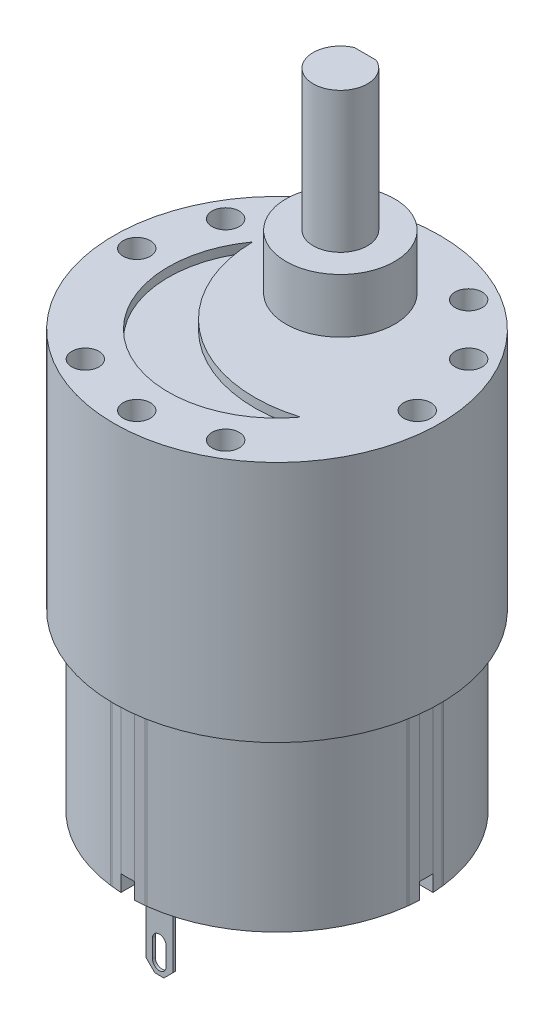
from build123d import *

# Parameters (mm, degrees)
SKETCH4_R            = 18
BOSS_EXTRUDE1_DEPTH  = 26.8
CUT_EXTRUDE1_DEPTH   = 1
SKETCH4_5_R          = 6
BOSS_EXTRUDE2_DEPTH  = 6
BOSS_EXTRUDE3_DEPTH  = 9.5
BOSS_EXTRUDE4_DEPTH  = 21.5
SKETCH4_9_R          = 1.5
CUT_EXTRUDE2_DEPTH   = 6
SKETCH5_W            = 3
SKETCH5_H            = 7
BOSS_EXTRUDE6_DEPTH  = 19.2
BOSS_EXTRUDE8_DEPTH  = 21.7
BOSS_EXTRUDE9_DEPTH  = 21.5
BOSS_EXTRUDE10_DEPTH = 17.4
BOSS_EXTRUDE11_DEPTH = 19.2
SKETCH5_15_W         = 3
SKETCH5_15_H         = 0.3
BOSS_EXTRUDE16_DEPTH = 28.5
CUT_EXTRUDE4_DEPTH   = 28.5
SKETCH5_11_R         = 3.5
SKETCH5_11_R_2       = 1.4
BOSS_EXTRUDE12_DEPTH = 25.2
SKETCH5_12_R         = 1.4
BOSS_EXTRUDE13_DEPTH = 25
BOSS_EXTRUDE14_DEPTH = 16
SKETCH5_14_W         = 3
SKETCH5_14_H         = 7
BOSS_EXTRUDE15_DEPTH = 17
CUT_EXTRUDE3_DEPTH   = 28.5


with BuildPart() as part:
    # Sketch4 → Boss-Extrude1 (new body)
    with BuildSketch(Plane(origin=(0, 0, 0), x_dir=(1, 0, 0), z_dir=(0, 1, 0))):
        Circle(SKETCH4_R)
    extrude(amount=-BOSS_EXTRUDE1_DEPTH)

    # Sketch4<4> → Cut-Extrude1 (cut)
    with BuildSketch(Plane(origin=(0, 0, 0), x_dir=(1, 0, 0), z_dir=(0, 1, 0))):
        with BuildLine():
            ThreePointArc((-9.722284336, 7.034002224), (-3.543208702, -4.874728217), (9.691213914, -7.07674875))
            ThreePointArc((9.691213914, -7.07674875), (-7.05539259, -9.706772656), (-9.722284336, 7.034002224))
        make_face()
    extrude(amount=-CUT_EXTRUDE1_DEPTH, mode=Mode.SUBTRACT)

    # Sketch4<9> → Cut-Extrude2 (cut)
    with BuildSketch(Plane(origin=(0, 0, 0), x_dir=(1, 0, 0), z_dir=(0, 1, 0))):
        with Locations((7.75, -13.423393759)):
            Circle(SKETCH4_9_R)
        with Locations((7.75, 13.423393759)):
            Circle(SKETCH4_9_R)
        with Locations((15.5, 0)):
            Circle(SKETCH4_9_R)
        with Locations((-15.5, 0)):
            Circle(SKETCH4_9_R)
        with Locations((-7.75, -13.423393759)):
            Circle(SKETCH4_9_R)
        with Locations((-13.423393759, 7.75)):
            Circle(SKETCH4_9_R)
        with Locations((0, -15.5)):
            Circle(SKETCH4_9_R)
        with Locations((-7.75, 13.423393759)):
            Circle(SKETCH4_9_R)
        with Locations((13.423393759, 7.75)):
            Circle(SKETCH4_9_R)
    extrude(amount=-CUT_EXTRUDE2_DEPTH, mode=Mode.SUBTRACT)

    # Sketch5 → Boss-Extrude6 (add)
    with BuildSketch(Plane.XZ.offset(26.8)):
        with BuildLine():
            Line((2, -13.5), (2, -16.378339354))
            ThreePointArc((2, -16.378339354), (11.66726189, -11.66726189), (16.378339354, -2))
            Line((16.378339354, -2), (13.5, -2))
            Line((13.5, -2), (13.5, 2))
            Line((13.5, 2), (16.378339354, 2))
            ThreePointArc((16.378339354, 2), (11.66726189, 11.66726189), (2, 16.378339354))
            Line((2, 16.378339354), (2, 13.5))
            Line((2, 13.5), (-2, 13.5))
            Line((-2, 13.5), (-2, 16.378339354))
            ThreePointArc((-2, 16.378339354), (-11.66726189, 11.66726189), (-16.378339354, 2))
            Line((-16.378339354, 2), (-13.5, 2))
            Line((-13.5, 2), (-13.5, -2))
            Line((-13.5, -2), (-16.378339354, -2))
            ThreePointArc((-16.378339354, -2), (-11.66726189, -11.66726189), (-2, -16.378339354))
            Line((-2, -16.378339354), (-2, -13.5))
            Line((-2, -13.5), (2, -13.5))
        make_face()
        with BuildLine():
            ThreePointArc((-5.891000616, 2.747018701), (-5.226537591, 2.988863464), (-4.984692829, 2.32440044))
            ThreePointArc((-4.984692829, 2.32440044), (-5.494765219, -0.239906631), (-4.763139721, -2.75))
            ThreePointArc((-4.763139721, -2.75), (-4.946152423, -3.433012702), (-5.629165125, -3.25))
            ThreePointArc((-5.629165125, -3.25), (-6.49381344, -0.283526018), (-5.891000616, 2.747018701))
        make_face(mode=Mode.SUBTRACT)
        Polygon((-1.5, -13), (-1.5, -12.7), (-0.5, -12.7), (0.5, -12.7), (1.5, -12.7), (1.5, -13), (0.5, -13), (-0.5, -13), align=None, mode=Mode.SUBTRACT)
        with BuildLine():
            ThreePointArc((-2.852673267, -6.117577562), (-3.215440411, -5.120883026), (-2.218745874, -4.758115882))
            ThreePointArc((-2.218745874, -4.758115882), (0, -5.25), (2.218745874, -4.758115882))
            ThreePointArc((2.218745874, -4.758115882), (3.215440411, -5.120883026), (2.852673267, -6.117577562))
            ThreePointArc((2.852673267, -6.117577562), (0, -6.75), (-2.852673267, -6.117577562))
        make_face(mode=Mode.SUBTRACT)
        with BuildLine():
            ThreePointArc((4.984692829, 2.32440044), (5.226537591, 2.988863464), (5.891000616, 2.747018701))
            ThreePointArc((5.891000616, 2.747018701), (6.49381344, -0.283526018), (5.629165125, -3.25))
            ThreePointArc((5.629165125, -3.25), (4.946152423, -3.433012702), (4.763139721, -2.75))
            ThreePointArc((4.763139721, -2.75), (5.494765219, -0.239906631), (4.984692829, 2.32440044))
        make_face(mode=Mode.SUBTRACT)
        with Locations((-10.5, 0)):
            Rectangle(SKETCH5_W, SKETCH5_H, mode=Mode.SUBTRACT)
        with BuildLine():
            ThreePointArc((3.5, 0), (0, -3.5), (-3.5, 0))
            ThreePointArc((-3.5, 0), (0, 3.5), (3.5, 0))
        make_face(mode=Mode.SUBTRACT)
        with BuildLine():
            ThreePointArc((2.852673267, 6.117577563), (3.215440411, 5.120883026), (2.218745874, 4.758115882))
            ThreePointArc((2.218745874, 4.758115882), (0, 5.25), (-2.218745874, 4.758115882))
            ThreePointArc((-2.218745874, 4.758115882), (-3.215435657, 5.120885242), (-2.852673267, 6.117577562))
            ThreePointArc((-2.852673267, 6.117577562), (0, 6.75), (2.852673267, 6.117577563))
        make_face(mode=Mode.SUBTRACT)
        with BuildLine():
            ThreePointArc((10.399755544, 1.496672836), (10.49982303, 1.500015644), (10.599890599, 1.496675333))
            ThreePointArc((10.599890599, 1.496675333), (11.560488683, 1.060689048), (11.996498936, 0.100101844))
            ThreePointArc((11.996498936, 0.100101844), (11.999005809, 0.050086648), (11.999841744, 1.5644e-05))
            ThreePointArc((11.999841744, 1.5644e-05), (11.999006434, -0.050036657), (11.996501433, -0.100033212))
            ThreePointArc((11.996501433, -0.100033212), (11.560515148, -1.060631295), (10.599927944, -1.496641549))
            ThreePointArc((10.599927944, -1.496641549), (10.499860458, -1.499984356), (10.399792888, -1.496644046))
            ThreePointArc((10.399792888, -1.496644046), (9.439194805, -1.060657761), (9.003184551, -0.100070556))
            ThreePointArc((9.003184551, -0.100070556), (8.999841744, -3.07e-06), (9.003182054, 0.100064499))
            ThreePointArc((9.003182054, 0.100064499), (9.439168339, 1.060662583), (10.399755544, 1.496672836))
        make_face(mode=Mode.SUBTRACT)
        Polygon((-1.5, 12.7), (-1.5, 13), (-0.5, 13), (0.5, 13), (1.5, 13), (1.5, 12.7), (0.5, 12.7), (-0.5, 12.7), align=None, mode=Mode.SUBTRACT)
    extrude(amount=BOSS_EXTRUDE6_DEPTH)

    # Sketch5<6> → Boss-Extrude8 (add)
    with BuildSketch(Plane.XZ.offset(26.8)):
        with BuildLine():
            Line((11.996498936, 0.100101844), (10.599908023, 0.10008442))
            Line((10.599908023, 0.10008442), (10.599890599, 1.496675333))
            ThreePointArc((10.599890599, 1.496675333), (10.49982303, 1.500015644), (10.399755544, 1.496672836))
            Line((10.399755544, 1.496672836), (10.399772967, 0.100081923))
            Line((10.399772967, 0.100081923), (9.003182054, 0.100064499))
            ThreePointArc((9.003182054, 0.100064499), (8.999841744, -3.07e-06), (9.003184551, -0.100070556))
            Line((9.003184551, -0.100070556), (10.399775464, -0.100053133))
            Line((10.399775464, -0.100053133), (10.399792888, -1.496644046))
            ThreePointArc((10.399792888, -1.496644046), (10.499860458, -1.499984356), (10.599927944, -1.496641549))
            Line((10.599927944, -1.496641549), (10.59991052, -0.100050636))
            Line((10.59991052, -0.100050636), (11.996501433, -0.100033212))
            ThreePointArc((11.996501433, -0.100033212), (11.999006434, -0.050036657), (11.999841744, 1.5644e-05))
            ThreePointArc((11.999841744, 1.5644e-05), (11.999005809, 0.050086648), (11.996498936, 0.100101844))
        make_face()
    extrude(amount=BOSS_EXTRUDE8_DEPTH)

    # Sketch5<7> → Boss-Extrude9 (add)
    with BuildSketch(Plane.XZ.offset(26.8)):
        with BuildLine():
            Line((10.599890599, 1.496675333), (10.599908023, 0.10008442))
            Line((10.599908023, 0.10008442), (11.996498936, 0.100101844))
            ThreePointArc((11.996498936, 0.100101844), (11.560488683, 1.060689048), (10.599890599, 1.496675333))
        make_face()
        with BuildLine():
            Line((10.399772967, 0.100081923), (10.399755544, 1.496672836))
            ThreePointArc((10.399755544, 1.496672836), (9.439168339, 1.060662583), (9.003182054, 0.100064499))
            Line((9.003182054, 0.100064499), (10.399772967, 0.100081923))
        make_face()
        with BuildLine():
            ThreePointArc((10.599927944, -1.496641549), (11.560515148, -1.060631295), (11.996501433, -0.100033212))
            Line((11.996501433, -0.100033212), (10.59991052, -0.100050636))
            Line((10.59991052, -0.100050636), (10.599927944, -1.496641549))
        make_face()
        with BuildLine():
            Line((10.399775464, -0.100053133), (9.003184551, -0.100070556))
            ThreePointArc((9.003184551, -0.100070556), (9.439194805, -1.060657761), (10.399792888, -1.496644046))
            Line((10.399792888, -1.496644046), (10.399775464, -0.100053133))
        make_face()
    extrude(amount=BOSS_EXTRUDE9_DEPTH)

    # Sketch5<8> → Boss-Extrude10 (add)
    with BuildSketch(Plane.XZ.offset(26.8)):
        with BuildLine():
            ThreePointArc((-0.75, -16.482945732), (0, -16.5), (0.75, -16.482945732))
            Line((0.75, -16.482945732), (0.75, -14.7))
            Line((0.75, -14.7), (-0.75, -14.7))
            Line((-0.75, -14.7), (-0.75, -16.482945732))
        make_face()
        with BuildLine():
            Line((14.7, -0.75), (16.482945732, -0.75))
            ThreePointArc((16.482945732, -0.75), (16.5, 0), (16.482945732, 0.75))
            Line((16.482945732, 0.75), (14.7, 0.75))
            Line((14.7, 0.75), (14.7, -0.75))
        make_face()
        with BuildLine():
            ThreePointArc((-16.482945732, 0.75), (-16.5, 0), (-16.482945732, -0.75))
            Line((-16.482945732, -0.75), (-14.7, -0.75))
            Line((-14.7, -0.75), (-14.7, 0.75))
            Line((-14.7, 0.75), (-16.482945732, 0.75))
        make_face()
        with BuildLine():
            Line((0.75, 14.7), (0.75, 16.482945732))
            ThreePointArc((0.75, 16.482945732), (0, 16.5), (-0.75, 16.482945732))
            Line((-0.75, 16.482945732), (-0.75, 14.7))
            Line((-0.75, 14.7), (0.75, 14.7))
        make_face()
    extrude(amount=BOSS_EXTRUDE10_DEPTH)

    # Sketch5<10> → Boss-Extrude11 (add)
    with BuildSketch(Plane.XZ.offset(26.8)):
        Polygon((0.75, -14.7), (0.75, -16.482945732), (1.808254963, -16.400616268), (1.99, -16.379501153), (1.99, -13.51), (-1.99, -13.51), (-1.99, -16.379501153), (-1.808254963, -16.400616268), (-0.75, -16.482945732), (-0.75, -14.7), align=None)
        Polygon((13.51, -1.99), (16.379501153, -1.99), (16.400616268, -1.808254963), (16.482945732, -0.75), (14.7, -0.75), (14.7, 0.75), (16.482945732, 0.75), (16.400616268, 1.808254963), (16.379501153, 1.99), (13.51, 1.99), align=None)
        Polygon((-16.400616268, -1.808254963), (-16.379501153, -1.99), (-13.51, -1.99), (-13.51, 1.99), (-16.379501153, 1.99), (-16.400616268, 1.808254963), (-16.482945732, 0.75), (-14.7, 0.75), (-14.7, -0.75), (-16.482945732, -0.75), align=None)
        Polygon((1.99, 13.51), (1.99, 16.379501153), (1.808254963, 16.400616268), (0.75, 16.482945732), (0.75, 14.7), (-0.75, 14.7), (-0.75, 16.482945732), (-1.808254963, 16.400616268), (-1.99, 16.379501153), (-1.99, 13.51), align=None)
    extrude(amount=BOSS_EXTRUDE11_DEPTH)

    # Sketch5<15> → Boss-Extrude16 (add)
    with BuildSketch(Plane.XZ.offset(26.8)):
        with Locations((0, 12.85)):
            Rectangle(SKETCH5_15_W, SKETCH5_15_H)
        with Locations((0, -12.85)):
            Rectangle(SKETCH5_15_W, SKETCH5_15_H)
    extrude(amount=BOSS_EXTRUDE16_DEPTH)

    # Sketch9 → Cut-Extrude4 (cut)
    with BuildSketch(Plane.XY.offset(13)):
        with BuildLine():
            Line((-0.75, -54.1), (-0.75, -52.1))
            ThreePointArc((-0.75, -52.1), (0, -51.35), (0.75, -52.1))
            Line((0.75, -52.1), (0.75, -54.1))
            ThreePointArc((0.75, -54.1), (0, -54.85), (-0.75, -54.1))
        make_face()
    extrude(amount=-CUT_EXTRUDE4_DEPTH, mode=Mode.SUBTRACT)

    # Sketch5<11> → Boss-Extrude12 (add)
    with BuildSketch(Plane.XZ.offset(26.8)):
        Circle(SKETCH5_11_R)
        Circle(SKETCH5_11_R_2, mode=Mode.SUBTRACT)
    extrude(amount=BOSS_EXTRUDE12_DEPTH)

    # Sketch5<12> → Boss-Extrude13 (add)
    with BuildSketch(Plane.XZ.offset(26.8)):
        Circle(SKETCH5_12_R)
    extrude(amount=BOSS_EXTRUDE13_DEPTH)

    # Sketch5<13> → Boss-Extrude14 (add)
    with BuildSketch(Plane.XZ.offset(26.8)):
        with BuildLine():
            ThreePointArc((5.629165125, -3.25), (6.49381344, -0.283526018), (5.891000616, 2.747018701))
            ThreePointArc((5.891000616, 2.747018701), (5.226537591, 2.988863464), (4.984692829, 2.32440044))
            ThreePointArc((4.984692829, 2.32440044), (5.494765219, -0.239906631), (4.763139721, -2.75))
            ThreePointArc((4.763139721, -2.75), (4.946152423, -3.433012702), (5.629165125, -3.25))
        make_face()
        with BuildLine():
            ThreePointArc((2.218745874, -4.758115882), (0, -5.25), (-2.218745874, -4.758115882))
            ThreePointArc((-2.218745874, -4.758115882), (-3.215440411, -5.120883026), (-2.852673267, -6.117577562))
            ThreePointArc((-2.852673267, -6.117577562), (0, -6.75), (2.852673267, -6.117577562))
            ThreePointArc((2.852673267, -6.117577562), (3.215440411, -5.120883026), (2.218745874, -4.758115882))
        make_face()
        with BuildLine():
            ThreePointArc((-2.218745874, 4.758115882), (0, 5.25), (2.218745874, 4.758115882))
            ThreePointArc((2.218745874, 4.758115882), (3.215440411, 5.120883026), (2.852673267, 6.117577563))
            ThreePointArc((2.852673267, 6.117577563), (0, 6.75), (-2.852673267, 6.117577562))
            ThreePointArc((-2.852673267, 6.117577562), (-3.215435657, 5.120885242), (-2.218745874, 4.758115882))
        make_face()
        with BuildLine():
            ThreePointArc((-4.763139721, -2.75), (-5.494765219, -0.239906631), (-4.984692829, 2.32440044))
            ThreePointArc((-4.984692829, 2.32440044), (-5.226537591, 2.988863464), (-5.891000616, 2.747018701))
            ThreePointArc((-5.891000616, 2.747018701), (-6.49381344, -0.283526018), (-5.629165125, -3.25))
            ThreePointArc((-5.629165125, -3.25), (-4.946152423, -3.433012702), (-4.763139721, -2.75))
        make_face()
    extrude(amount=BOSS_EXTRUDE14_DEPTH)

    # Sketch5<14> → Boss-Extrude15 (add)
    with BuildSketch(Plane.XZ.offset(26.8)):
        with Locations((-10.5, 0)):
            Rectangle(SKETCH5_14_W, SKETCH5_14_H)
    extrude(amount=BOSS_EXTRUDE15_DEPTH)

    # Sketch8 → Cut-Extrude3 (cut)
    with BuildSketch(Plane(origin=(0, 0, -13), x_dir=(-1, 0, 0), z_dir=(0, 0, -1))):
        Polygon((1.5, -54.3), (0.5, -55.3), (1.5, -55.3), align=None)
        Polygon((-0.5, -55.3), (-1.5, -55.3), (-1.5, -54.3), align=None)
    extrude(amount=-CUT_EXTRUDE3_DEPTH, mode=Mode.SUBTRACT)


with BuildPart() as body_2:
    # Sketch4<5> → Boss-Extrude2 (new body)
    with BuildSketch(Plane(origin=(0, 0, 0), x_dir=(1, 0, 0), z_dir=(0, 1, 0))):
        with Locations((0, 7)):
            Circle(SKETCH4_5_R)
        with BuildLine():
            ThreePointArc((-1.198957881, 9.75), (0, 10), (1.198957881, 9.75))
            ThreePointArc((1.198957881, 9.75), (0, 4), (-1.198957881, 9.75))
        make_face(mode=Mode.SUBTRACT)
    extrude(amount=BOSS_EXTRUDE2_DEPTH)

    # Sketch4<7> → Boss-Extrude3 (add)
    with BuildSketch(Plane(origin=(0, 0, 0), x_dir=(1, 0, 0), z_dir=(0, 1, 0))):
        with BuildLine():
            Line((-1.198957881, 9.75), (1.198957881, 9.75))
            ThreePointArc((1.198957881, 9.75), (0, 10), (-1.198957881, 9.75))
        make_face()
    extrude(amount=BOSS_EXTRUDE3_DEPTH)

    # Sketch4<8> → Boss-Extrude4 (add)
    with BuildSketch(Plane(origin=(0, 0, 0), x_dir=(1, 0, 0), z_dir=(0, 1, 0))):
        with BuildLine():
            ThreePointArc((-1.198957881, 9.75), (0, 4), (1.198957881, 9.75))
            Line((1.198957881, 9.75), (-1.198957881, 9.75))
        make_face()
    extrude(amount=BOSS_EXTRUDE4_DEPTH)


solid = Compound([part.part, body_2.part])
